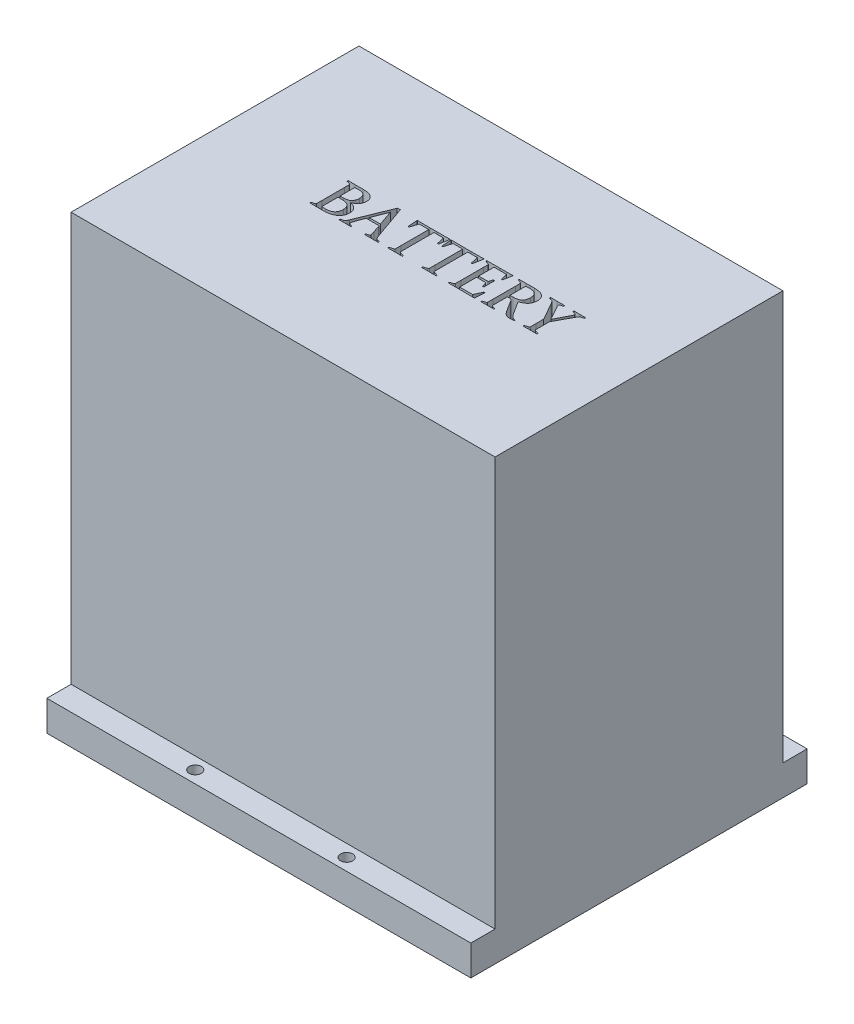
from build123d import *

# Parameters (mm, degrees)
SKETCH1_W           = 140
SKETCH1_H           = 95.06
BOSS_EXTRUDE1_DEPTH = 135
CUT_EXTRUDE1_DEPTH  = 10
SKETCH5_W           = 140
SKETCH5_H           = 111.06
SKETCH5_R           = 2
SKETCH5_R_2         = 1.194483332
SKETCH5_R_3         = 1.393191893
BOSS_EXTRUDE2_DEPTH = 10
SKETCH6_R           = 2
CUT_EXTRUDE2_DEPTH  = 206.46865484


with BuildPart() as part:
    # Sketch1 → Boss-Extrude1 (new body)
    with BuildSketch(Plane(origin=(0, 0, 0), x_dir=(1, 0, 0), z_dir=(0, 1, 0))):
        with Locations((-34.524886878, -45.795791855)):
            Rectangle(SKETCH1_W, SKETCH1_H)
    extrude(amount=BOSS_EXTRUDE1_DEPTH)

    # Sketch3 → Cut-Extrude1 (cut)
    # profile 1 of 7: a face of its own
    with BuildSketch(Plane(origin=(0, 135, 0), x_dir=(1, 0, 0), z_dir=(0, 1, 0))):
        with BuildLine():
            add(Edge.make_bspline(
                [(-67.809019882, -38.536040297), (-67.427547121, -38.546417855), (-66.669108469, -38.567050367), (-65.910393126, -38.569341939), (-65.533289712, -38.570480917)],
                knots=[0, 0, 0, 0, 1.005942301, 2, 2, 2, 2], degree=3))
            add(Edge.make_bspline(
                [(-65.533289712, -38.570480917), (-65.451169222, -38.567544733), (-65.264892055, -38.560884471), (-64.953094953, -38.557151408), (-64.57514416, -38.551262412), (-64.155660359, -38.547033522), (-63.740624652, -38.540800795), (-63.380303502, -38.539506194), (-63.096843529, -38.535502588), (-62.934348381, -38.535880219), (-62.865466334, -38.536040297)],
                knots=[0, 0, 0, 0, 0.73913045, 1.676598947, 2.80468887, 4.139292672, 5.450067671, 6.538357173, 7.380406424, 8, 8, 8, 8], degree=3))
            add(Edge.make_bspline(
                [(-62.865466334, -38.536040297), (-62.703774907, -38.537430001), (-62.390525449, -38.540122314), (-61.936010606, -38.579154485), (-61.51145673, -38.636757738), (-61.11549324, -38.713545577), (-60.751950727, -38.820593897), (-60.417858436, -38.947108155), (-60.114448975, -39.097674369), (-59.842426737, -39.272850081), (-59.603227642, -39.47091103), (-59.389655057, -39.68488596), (-59.215935664, -39.926858102), (-59.067795267, -40.183925865), (-58.955693763, -40.464150085), (-58.877496749, -40.764124192), (-58.828406865, -41.084806574), (-58.822864742, -41.305236873), (-58.820018173, -41.418455228)],
                knots=[0, 0, 0, 0, 1.378203886, 2.670034086, 3.88606819, 5.030458177, 6.105049954, 7.113226739, 8.072889222, 8.987638, 9.864930817, 10.716848378, 11.557174684, 12.396758562, 13.241257251, 14.12154981, 15.035182359, 16, 16, 16, 16], degree=3))
            add(Edge.make_bspline(
                [(-58.820018173, -41.418455228), (-58.820908478, -41.510408625), (-58.822651146, -41.69039663), (-58.855124518, -41.95465016), (-58.896719198, -42.208981625), (-58.965856813, -42.450581441), (-59.045185739, -42.682889705), (-59.152216652, -42.900353287), (-59.268678788, -43.111588819), (-59.412009446, -43.306468355), (-59.567088476, -43.494858725), (-59.747673955, -43.665206173), (-59.939750318, -43.831257244), (-60.154115788, -43.982707642), (-60.386989663, -44.121775893), (-60.637761757, -44.252780371), (-60.906674727, -44.371789686), (-61.095284608, -44.438948204), (-61.191122367, -44.473073256)],
                knots=[0, 0, 0, 0, 1.057010299, 2.068973867, 3.05944387, 4.018196596, 4.956492417, 5.878980143, 6.802641909, 7.727364617, 8.657429372, 9.605791154, 10.578809353, 11.576753923, 12.620399978, 13.697337371, 14.829955113, 16, 16, 16, 16], degree=3))
            add(Edge.make_bspline(
                [(-61.191122367, -44.473073256), (-61.078616777, -44.493539302), (-60.858163497, -44.533642261), (-60.540869206, -44.61966028), (-60.242552593, -44.719019596), (-59.965316303, -44.839048116), (-59.708370188, -44.976515321), (-59.470457364, -45.13112253), (-59.252059911, -45.303007191), (-59.057015689, -45.494737075), (-58.879663425, -45.69850536), (-58.730153546, -45.919869868), (-58.597763617, -46.151517817), (-58.491555036, -46.398404672), (-58.413000303, -46.660259651), (-58.354917674, -46.934917554), (-58.315856557, -47.222791096), (-58.312870836, -47.419823984), (-58.311356715, -47.519743449)],
                knots=[0, 0, 0, 0, 1.187931728, 2.327737193, 3.413187731, 4.453183684, 5.463269064, 6.438220556, 7.398548252, 8.346117218, 9.276870068, 10.200947513, 11.117336382, 12.046458873, 12.987068854, 13.953690983, 14.962274252, 16, 16, 16, 16], degree=3))
            add(Edge.make_bspline(
                [(-58.311356715, -47.519743449), (-58.315455324, -47.663906306), (-58.323464481, -47.945617211), (-58.385222602, -48.356283724), (-58.487591687, -48.742681266), (-58.634536307, -49.102765096), (-58.821657173, -49.437741294), (-59.050786461, -49.747298609), (-59.3244488, -50.028743356), (-59.634616468, -50.286578643), (-59.98343952, -50.513191887), (-60.363448821, -50.713141377), (-60.776888122, -50.878919717), (-61.221252479, -51.017865636), (-61.69857691, -51.121328396), (-62.207208779, -51.198902245), (-62.747228976, -51.243155497), (-63.117952305, -51.249385008), (-63.307895831, -51.252576755)],
                knots=[0, 0, 0, 0, 0.981867809, 1.918683317, 2.822078413, 3.699124559, 4.561079493, 5.429873538, 6.31493128, 7.229318538, 8.172142545, 9.1436515, 10.15029445, 11.202629439, 12.312014813, 13.474334065, 14.705951703, 16, 16, 16, 16], degree=3))
            add(Edge.make_bspline(
                [(-63.307895831, -51.252576755), (-63.46950963, -51.252288886), (-63.806017329, -51.251689494), (-64.334035588, -51.238597476), (-64.915069564, -51.226400232), (-65.321339055, -51.226193285), (-65.53593899, -51.226083971)],
                knots=[0, 0, 0, 0, 0.870320471, 1.812156761, 2.844336023, 4, 4, 4, 4], degree=3))
            add(Edge.make_bspline(
                [(-65.53593899, -51.226083971), (-65.905970003, -51.226565663), (-66.652275977, -51.227537175), (-67.398397366, -51.244183804), (-67.774579262, -51.252576755)],
                knots=[0, 0, 0, 0, 0.991633528, 2, 2, 2, 2], degree=3))
            Line((-67.774579262, -51.252576755), (-67.809019882, -50.913469116))
            Line((-67.809019882, -50.913469116), (-66.709569334, -50.574361478))
            add(Edge.make_bspline(
                [(-66.709569334, -50.574361478), (-66.675942332, -50.562088632), (-66.612088416, -50.538783872), (-66.534063804, -50.475564404), (-66.482006467, -50.390399903), (-66.473146081, -50.325191923), (-66.468484997, -50.290888686)],
                knots=[0, 0, 0, 0, 1.072356029, 2.036284212, 2.966969876, 4, 4, 4, 4], degree=3))
            add(Edge.make_bspline(
                [(-66.468484997, -50.290888686), (-66.465555591, -50.161961552), (-66.459376186, -49.889997577), (-66.455510446, -49.459012658), (-66.448317011, -48.982164606), (-66.44938214, -48.648339378), (-66.449940048, -48.473483684)],
                knots=[0, 0, 0, 0, 0.851424291, 1.796027954, 2.845572385, 4, 4, 4, 4], degree=3))
            Line((-66.449940048, -48.473483684), (-66.449940048, -41.06080264))
            add(Edge.make_bspline(
                [(-66.449940048, -41.06080264), (-66.449371916, -40.913322078), (-66.44829344, -40.633362171), (-66.455513156, -40.234230992), (-66.459354675, -39.875651885), (-66.465554368, -39.649614983), (-66.468484997, -39.5427661)],
                knots=[0, 0, 0, 0, 1.165661162, 2.212755269, 3.155159611, 4, 4, 4, 4], degree=3))
            add(Edge.make_bspline(
                [(-66.468484997, -39.5427661), (-66.471341905, -39.505942968), (-66.476727369, -39.436528909), (-66.522648151, -39.344665725), (-66.590420393, -39.270774565), (-66.651655601, -39.245678032), (-66.68307655, -39.232800524)],
                knots=[0, 0, 0, 0, 1.089053236, 2.052937975, 3.000925474, 4, 4, 4, 4], degree=3))
            Line((-66.68307655, -39.232800524), (-67.790474933, -38.875147936))
            Line((-67.790474933, -38.875147936), (-67.809019882, -38.536040297))
        make_face()
        with BuildLine():
            Line((-64.754401853, -44.979085436), (-64.754401853, -50.256448066))
            add(Edge.make_bspline(
                [(-64.754401853, -50.256448066), (-64.65605006, -50.284658389), (-64.447929201, -50.34435386), (-64.116843115, -50.382381639), (-63.78142988, -50.397938133), (-63.55959909, -50.402586583), (-63.453606145, -50.404807658)],
                knots=[0, 0, 0, 0, 0.932933746, 1.974168104, 3.032037493, 4, 4, 4, 4], degree=3))
            add(Edge.make_bspline(
                [(-63.453606145, -50.404807658), (-63.330767627, -50.403124731), (-63.091639932, -50.399848604), (-62.744625017, -50.364433136), (-62.419650166, -50.309173621), (-62.116571324, -50.233924872), (-61.83739735, -50.13262053), (-61.580072944, -50.010641728), (-61.346449996, -49.864621599), (-61.135430096, -49.69694897), (-60.948639857, -49.507469505), (-60.786443761, -49.297722805), (-60.650069368, -49.066964092), (-60.539416024, -48.816814182), (-60.450634929, -48.547351348), (-60.391446195, -48.256565414), (-60.353632767, -47.946388047), (-60.348589495, -47.73268453), (-60.346002548, -47.623065308)],
                knots=[0, 0, 0, 0, 1.238057209, 2.410105338, 3.512269806, 4.559560237, 5.553733266, 6.501495605, 7.425414509, 8.325034372, 9.212724115, 10.101350968, 10.991537483, 11.9081781, 12.854182454, 13.846000613, 14.895105975, 16, 16, 16, 16], degree=3))
            add(Edge.make_bspline(
                [(-60.346002548, -47.623065308), (-60.348666269, -47.513466888), (-60.353837904, -47.300680758), (-60.390188275, -46.99261248), (-60.454165101, -46.707042144), (-60.54138696, -46.443090734), (-60.652717878, -46.199583246), (-60.790592681, -45.977805268), (-60.957241654, -45.780737435), (-61.146884547, -45.603583227), (-61.365399797, -45.448568437), (-61.612601292, -45.312285035), (-61.893430381, -45.203620437), (-62.202153165, -45.109610008), (-62.542989393, -45.040393906), (-62.913422688, -44.986464976), (-63.315433327, -44.959112307), (-63.59310161, -44.954818887), (-63.737078937, -44.952592652)],
                knots=[0, 0, 0, 0, 1.05999139, 2.057980992, 2.994616073, 3.885952831, 4.742010155, 5.578585574, 6.403171339, 7.231156379, 8.082085007, 8.988034817, 9.953965965, 10.988883383, 12.106237805, 13.314170885, 14.607336449, 16, 16, 16, 16], degree=3))
            add(Edge.make_bspline(
                [(-63.737078937, -44.952592652), (-63.90843494, -44.952984912), (-64.247753603, -44.953761665), (-64.586648806, -44.970700645), (-64.754401853, -44.979085436)],
                knots=[0, 0, 0, 0, 1.010000458, 2, 2, 2, 2], degree=3))
        make_face(mode=Mode.SUBTRACT)
        with BuildLine():
            add(Edge.make_bspline(
                [(-64.754401853, -44.292922323), (-64.562772242, -44.294910272), (-64.177753045, -44.29890443), (-63.79271534, -44.300212921), (-63.599316458, -44.300870158)],
                knots=[0, 0, 0, 0, 0.995428867, 2, 2, 2, 2], degree=3))
            add(Edge.make_bspline(
                [(-63.599316458, -44.300870158), (-63.489755054, -44.298676327), (-63.276415266, -44.294404464), (-62.967193463, -44.26605633), (-62.678234196, -44.215867258), (-62.410614699, -44.144489167), (-62.162982894, -44.054589507), (-61.935589601, -43.946248387), (-61.729902543, -43.815727805), (-61.546170365, -43.663882675), (-61.383694839, -43.49228408), (-61.23909712, -43.304521638), (-61.120074181, -43.09522154), (-61.021316985, -42.869924216), (-60.948054208, -42.624865793), (-60.891889207, -42.363768167), (-60.860488447, -42.083304966), (-60.856643088, -41.890984575), (-60.854664006, -41.792003486)],
                knots=[0, 0, 0, 0, 1.237178968, 2.409055454, 3.502577501, 4.545123155, 5.532558798, 6.47363837, 7.383776903, 8.276262588, 9.157930545, 10.047458661, 10.94544277, 11.869891171, 12.819334189, 13.828534526, 14.882416913, 16, 16, 16, 16], degree=3))
            add(Edge.make_bspline(
                [(-60.854664006, -41.792003486), (-60.856276096, -41.688570236), (-60.859386134, -41.489027096), (-60.895044492, -41.201010355), (-60.950057065, -40.934917185), (-61.025416047, -40.689596913), (-61.126835219, -40.468313975), (-61.249664009, -40.269070878), (-61.395865811, -40.093214037), (-61.565819318, -39.940833312), (-61.754868645, -39.808389449), (-61.962790296, -39.693934257), (-62.190537805, -39.598802907), (-62.437516591, -39.518711531), (-62.705703316, -39.459577656), (-62.992226357, -39.414119928), (-63.298556966, -39.387453357), (-63.509188234, -39.385049593), (-63.617861407, -39.383809394)],
                knots=[0, 0, 0, 0, 1.177231098, 2.271110987, 3.298638014, 4.268657357, 5.186615539, 6.062809601, 6.926742094, 7.781081906, 8.65432805, 9.549983417, 10.478238827, 11.460894017, 12.502544614, 13.601957102, 14.762752866, 16, 16, 16, 16], degree=3))
            add(Edge.make_bspline(
                [(-63.617861407, -39.383809394), (-63.700883994, -39.384179564), (-63.874941562, -39.384955627), (-64.146980935, -39.396749909), (-64.443183193, -39.413782186), (-64.647625969, -39.435860873), (-64.754401853, -39.447392077)],
                knots=[0, 0, 0, 0, 0.874677504, 1.83376891, 2.868626, 4, 4, 4, 4], degree=3))
            Line((-64.754401853, -39.447392077), (-64.754401853, -44.292922323))
        make_face(mode=Mode.SUBTRACT)
    # profile 2 of 7: a face of its own
    with BuildSketch(Plane(origin=(0, 135, 0), x_dir=(1, 0, 0), z_dir=(0, 1, 0))):
        with BuildLine():
            Line((-50.890727835, -38.196932658), (-46.922108749, -49.459015259))
            add(Edge.make_bspline(
                [(-46.922108749, -49.459015259), (-46.885663146, -49.556391089), (-46.818572642, -49.735644359), (-46.71727249, -49.97893096), (-46.617774069, -50.169388956), (-46.52207984, -50.317727821), (-46.415151059, -50.430782604), (-46.290833352, -50.520236854), (-46.149463946, -50.598234463), (-46.045791974, -50.636640187), (-45.992212021, -50.656489109)],
                knots=[0, 0, 0, 0, 1.574516787, 2.898432601, 3.987097625, 4.825290635, 5.56306803, 6.327976849, 7.135861677, 8, 8, 8, 8], degree=3))
            Line((-45.992212021, -50.656489109), (-45.14974148, -50.913469116))
            Line((-45.14974148, -50.913469116), (-45.13384581, -51.252576755))
            add(Edge.make_bspline(
                [(-45.13384581, -51.252576755), (-45.325480074, -51.249283394), (-45.70168619, -51.242818045), (-46.255315735, -51.229235603), (-46.787885158, -51.229307688), (-47.13581929, -51.227143899), (-47.306254121, -51.226083971)],
                knots=[0, 0, 0, 0, 1.058612849, 2.078212005, 3.058616038, 4, 4, 4, 4], degree=3))
            add(Edge.make_bspline(
                [(-47.306254121, -51.226083971), (-47.483754084, -51.227132376), (-47.853766087, -51.229317855), (-48.432247844, -51.229365395), (-49.056530067, -51.243051412), (-49.488373005, -51.249328915), (-49.711798935, -51.252576755)],
                knots=[0, 0, 0, 0, 0.885404967, 1.84569315, 2.885409556, 4, 4, 4, 4], degree=3))
            Line((-49.711798935, -51.252576755), (-49.746239554, -50.913469116))
            Line((-49.746239554, -50.913469116), (-48.898470457, -50.645891995))
            add(Edge.make_bspline(
                [(-48.898470457, -50.645891995), (-48.846417956, -50.624085931), (-48.755473136, -50.585986925), (-48.638131491, -50.50604919), (-48.572638726, -50.383620697), (-48.569216995, -50.291741085), (-48.567310653, -50.240552396)],
                knots=[0, 0, 0, 0, 1.191052092, 2.08097623, 2.930858445, 4, 4, 4, 4], degree=3))
            add(Edge.make_bspline(
                [(-48.567310653, -50.240552396), (-48.572947489, -50.165975309), (-48.58588283, -49.994836742), (-48.652354838, -49.773201628), (-48.714787482, -49.559195484), (-48.776571081, -49.365094737), (-48.848566327, -49.145662807), (-48.898557426, -48.990123051), (-48.924963241, -48.907965346)],
                knots=[0, 0, 0, 0, 0.970738523, 2.227638644, 2.994762933, 3.874229025, 4.877145812, 6, 6, 6, 6], degree=3))
            Line((-48.924963241, -48.907965346), (-49.764784503, -46.335515991))
            Line((-49.764784503, -46.335515991), (-54.075160507, -46.335515991))
            Line((-54.075160507, -46.335515991), (-55.013005071, -48.907965346))
            add(Edge.make_bspline(
                [(-55.013005071, -48.907965346), (-55.043443713, -48.993482262), (-55.100759002, -49.154508717), (-55.175727685, -49.384794235), (-55.248445012, -49.583904019), (-55.30857445, -49.758239647), (-55.353100293, -49.910604503), (-55.390319952, -50.043102204), (-55.408792127, -50.16057938), (-55.413516894, -50.233447242), (-55.415695392, -50.26704518)],
                knots=[0, 0, 0, 0, 1.53230722, 2.885300472, 4.087661103, 5.110660653, 5.997387815, 6.767555662, 7.431744164, 8, 8, 8, 8], degree=3))
            add(Edge.make_bspline(
                [(-55.415695392, -50.26704518), (-55.412958036, -50.315859519), (-55.407924413, -50.405622406), (-55.334909342, -50.522500589), (-55.218034627, -50.600003531), (-55.12690818, -50.6346873), (-55.076587753, -50.65383983)],
                knots=[0, 0, 0, 0, 1.036269142, 1.905557071, 2.843439335, 4, 4, 4, 4], degree=3))
            Line((-55.076587753, -50.65383983), (-54.244714326, -50.913469116))
            Line((-54.244714326, -50.913469116), (-54.226169377, -51.252576755))
            add(Edge.make_bspline(
                [(-54.226169377, -51.252576755), (-54.428402486, -51.249383273), (-54.812563624, -51.243316948), (-55.360003404, -51.229442517), (-55.849300338, -51.229348629), (-56.156612074, -51.227125341), (-56.300554387, -51.226083971)],
                knots=[0, 0, 0, 0, 1.169919131, 2.222373308, 3.16737414, 4, 4, 4, 4], degree=3))
            add(Edge.make_bspline(
                [(-56.300554387, -51.226083971), (-56.438314442, -51.227139717), (-56.721781928, -51.229312114), (-57.15898978, -51.229280213), (-57.619878998, -51.242911381), (-57.935155059, -51.249301294), (-58.096765162, -51.252576755)],
                knots=[0, 0, 0, 0, 0.920242704, 1.893574212, 2.920248855, 4, 4, 4, 4], degree=3))
            Line((-58.096765162, -51.252576755), (-58.141802895, -50.913469116))
            Line((-58.141802895, -50.913469116), (-57.238398951, -50.627347046))
            add(Edge.make_bspline(
                [(-57.238398951, -50.627347046), (-57.184475776, -50.609052337), (-57.080899193, -50.573911536), (-56.946307994, -50.490931843), (-56.827133897, -50.402338232), (-56.734518486, -50.285978373), (-56.653174352, -50.147505975), (-56.560107731, -49.986754325), (-56.473542851, -49.788283513), (-56.412616319, -49.646246507), (-56.38003274, -49.570284953)],
                knots=[0, 0, 0, 0, 0.960439586, 1.844829266, 2.664180003, 3.460297701, 4.339620655, 5.383436748, 6.600658962, 8, 8, 8, 8], degree=3))
            Line((-56.38003274, -49.570284953), (-51.812676729, -38.334695136))
            Line((-51.812676729, -38.334695136), (-50.890727835, -38.196932658))
        make_face()
        Polygon((-53.744000703, -45.657300714), (-50.058854409, -45.657300714), (-51.802079615, -40.599828193), align=None, mode=Mode.SUBTRACT)
    # profile 3 of 7: a face of its own
    with BuildSketch(Plane(origin=(0, 135, 0), x_dir=(1, 0, 0), z_dir=(0, 1, 0))):
        with BuildLine():
            add(Edge.make_bspline(
                [(-39.641891627, -51.226083971), (-39.826456241, -51.227137109), (-40.205299181, -51.229298811), (-40.790846489, -51.22931791), (-41.408065797, -51.242879996), (-41.831075724, -51.249295407), (-42.04743644, -51.252576755)],
                knots=[0, 0, 0, 0, 0.920642888, 1.889739583, 2.920646004, 4, 4, 4, 4], degree=3))
            Line((-42.04743644, -51.252576755), (-42.08187706, -50.913469116))
            Line((-42.08187706, -50.913469116), (-40.759887124, -50.508129517))
            add(Edge.make_bspline(
                [(-40.759887124, -50.508129517), (-40.726240452, -50.495956108), (-40.661812626, -50.472646038), (-40.584410998, -50.408074642), (-40.538290198, -50.320246307), (-40.530757514, -50.25611897), (-40.526750622, -50.222007447)],
                knots=[0, 0, 0, 0, 1.07619582, 2.060737424, 2.968439932, 4, 4, 4, 4], degree=3))
            add(Edge.make_bspline(
                [(-40.526750622, -50.222007447), (-40.523817632, -50.096612849), (-40.517580345, -49.829949051), (-40.513784791, -49.406026827), (-40.506567751, -48.933594867), (-40.507641575, -48.602418646), (-40.508205673, -48.42844595)],
                knots=[0, 0, 0, 0, 0.839114093, 1.784457676, 2.836136637, 4, 4, 4, 4], degree=3))
            Line((-40.508205673, -48.42844595), (-40.508205673, -39.214255575))
            Line((-40.508205673, -39.214255575), (-43.66614556, -39.214255575))
            Line((-43.66614556, -39.214255575), (-44.460929089, -41.760212145))
            Line((-44.460929089, -41.760212145), (-44.818581677, -41.826444106))
            Line((-44.818581677, -41.826444106), (-45.051718178, -38.573130195))
            Line((-45.051718178, -38.573130195), (-44.988135496, -38.501599677))
            add(Edge.make_bspline(
                [(-44.988135496, -38.501599677), (-44.625189054, -38.507242887), (-43.907264153, -38.518405417), (-42.842238874, -38.528962511), (-41.801057851, -38.533779174), (-41.11489076, -38.535292434), (-40.775782794, -38.536040297)],
                knots=[0, 0, 0, 0, 1.034026858, 2.045353098, 3.034001568, 4, 4, 4, 4], degree=3))
            Line((-40.775782794, -38.536040297), (-38.444417777, -38.536040297))
            add(Edge.make_bspline(
                [(-38.444417777, -38.536040297), (-38.106192912, -38.535290356), (-37.420025856, -38.533768927), (-36.377078676, -38.528957489), (-35.305872414, -38.518366881), (-34.582648306, -38.507238669), (-34.216169404, -38.501599677)],
                knots=[0, 0, 0, 0, 0.95986119, 1.947299551, 2.95983638, 4, 4, 4, 4], degree=3))
            Line((-34.216169404, -38.501599677), (-34.163183836, -38.573130195))
            Line((-34.163183836, -38.573130195), (-34.724830863, -41.762861423))
            Line((-34.724830863, -41.762861423), (-35.082483451, -41.826444106))
            Line((-35.082483451, -41.826444106), (-35.654727591, -39.214255575))
            Line((-35.654727591, -39.214255575), (-38.812667478, -39.214255575))
            Line((-38.812667478, -39.214255575), (-38.812667478, -48.42844595))
            add(Edge.make_bspline(
                [(-38.812667478, -48.42844595), (-38.813231577, -48.602418646), (-38.8143054, -48.933594867), (-38.80708836, -49.406026827), (-38.803292806, -49.829949051), (-38.797055519, -50.096612849), (-38.794122529, -50.222007447)],
                knots=[0, 0, 0, 0, 1.163863363, 2.215542324, 3.160885907, 4, 4, 4, 4], degree=3))
            add(Edge.make_bspline(
                [(-38.794122529, -50.222007447), (-38.790401467, -50.256298795), (-38.783359717, -50.321191846), (-38.733343407, -50.406365828), (-38.659141201, -50.473567109), (-38.594877685, -50.496195584), (-38.560986028, -50.508129517)],
                knots=[0, 0, 0, 0, 1.033432821, 1.955671374, 2.921850393, 4, 4, 4, 4], degree=3))
            Line((-38.560986028, -50.508129517), (-37.238996092, -50.913469116))
            Line((-37.238996092, -50.913469116), (-37.220451143, -51.252576755))
            add(Edge.make_bspline(
                [(-37.220451143, -51.252576755), (-37.443876967, -51.249322752), (-37.87660257, -51.24302048), (-38.503534708, -51.229350123), (-39.087314912, -51.229315499), (-39.461742397, -51.227133704), (-39.641891627, -51.226083971)],
                knots=[0, 0, 0, 0, 1.107274464, 2.144541755, 3.107278743, 4, 4, 4, 4], degree=3))
        make_face()
    # profile 4 of 7: a face of its own
    with BuildSketch(Plane(origin=(0, 135, 0), x_dir=(1, 0, 0), z_dir=(0, 1, 0))):
        with BuildLine():
            add(Edge.make_bspline(
                [(-28.451339543, -51.226083971), (-28.635904158, -51.227137109), (-29.014747097, -51.229298811), (-29.600294405, -51.22931791), (-30.217513713, -51.242879996), (-30.64052364, -51.249295407), (-30.856884357, -51.252576755)],
                knots=[0, 0, 0, 0, 0.920642888, 1.889739583, 2.920646004, 4, 4, 4, 4], degree=3))
            Line((-30.856884357, -51.252576755), (-30.891324976, -50.913469116))
            Line((-30.891324976, -50.913469116), (-29.56933504, -50.508129517))
            add(Edge.make_bspline(
                [(-29.56933504, -50.508129517), (-29.535688368, -50.495956108), (-29.471260543, -50.472646038), (-29.393858915, -50.408074642), (-29.347738114, -50.320246307), (-29.340205431, -50.25611897), (-29.336198539, -50.222007447)],
                knots=[0, 0, 0, 0, 1.07619582, 2.060737424, 2.968439932, 4, 4, 4, 4], degree=3))
            add(Edge.make_bspline(
                [(-29.336198539, -50.222007447), (-29.333265549, -50.096612849), (-29.327028262, -49.829949051), (-29.323232708, -49.406026827), (-29.316015668, -48.933594867), (-29.317089491, -48.602418646), (-29.31765359, -48.42844595)],
                knots=[0, 0, 0, 0, 0.839114093, 1.784457676, 2.836136637, 4, 4, 4, 4], degree=3))
            Line((-29.31765359, -48.42844595), (-29.31765359, -39.214255575))
            Line((-29.31765359, -39.214255575), (-32.475593477, -39.214255575))
            Line((-32.475593477, -39.214255575), (-33.270377005, -41.760212145))
            Line((-33.270377005, -41.760212145), (-33.628029593, -41.826444106))
            Line((-33.628029593, -41.826444106), (-33.861166095, -38.573130195))
            Line((-33.861166095, -38.573130195), (-33.797583413, -38.501599677))
            add(Edge.make_bspline(
                [(-33.797583413, -38.501599677), (-33.434636971, -38.507242887), (-32.71671207, -38.518405417), (-31.65168679, -38.528962511), (-30.610505768, -38.533779174), (-29.924338677, -38.535292434), (-29.585230711, -38.536040297)],
                knots=[0, 0, 0, 0, 1.034026858, 2.045353098, 3.034001568, 4, 4, 4, 4], degree=3))
            Line((-29.585230711, -38.536040297), (-27.253865693, -38.536040297))
            add(Edge.make_bspline(
                [(-27.253865693, -38.536040297), (-26.915640829, -38.535290356), (-26.229473773, -38.533768927), (-25.186526593, -38.528957489), (-24.115320331, -38.518366881), (-23.392096223, -38.507238669), (-23.025617321, -38.501599677)],
                knots=[0, 0, 0, 0, 0.95986119, 1.947299551, 2.95983638, 4, 4, 4, 4], degree=3))
            Line((-23.025617321, -38.501599677), (-22.972631753, -38.573130195))
            Line((-22.972631753, -38.573130195), (-23.534278779, -41.762861423))
            Line((-23.534278779, -41.762861423), (-23.891931367, -41.826444106))
            Line((-23.891931367, -41.826444106), (-24.464175508, -39.214255575))
            Line((-24.464175508, -39.214255575), (-27.622115395, -39.214255575))
            Line((-27.622115395, -39.214255575), (-27.622115395, -48.42844595))
            add(Edge.make_bspline(
                [(-27.622115395, -48.42844595), (-27.622679493, -48.602418646), (-27.623753317, -48.933594867), (-27.616536277, -49.406026827), (-27.612740723, -49.829949051), (-27.606503436, -50.096612849), (-27.603570446, -50.222007447)],
                knots=[0, 0, 0, 0, 1.163863363, 2.215542324, 3.160885907, 4, 4, 4, 4], degree=3))
            add(Edge.make_bspline(
                [(-27.603570446, -50.222007447), (-27.599849383, -50.256298795), (-27.592807633, -50.321191846), (-27.542791324, -50.406365828), (-27.468589118, -50.473567109), (-27.404325601, -50.496195584), (-27.370433944, -50.508129517)],
                knots=[0, 0, 0, 0, 1.033432821, 1.955671374, 2.921850393, 4, 4, 4, 4], degree=3))
            Line((-27.370433944, -50.508129517), (-26.048444008, -50.913469116))
            Line((-26.048444008, -50.913469116), (-26.029899059, -51.252576755))
            add(Edge.make_bspline(
                [(-26.029899059, -51.252576755), (-26.253324884, -51.249322752), (-26.686050487, -51.24302048), (-27.312982625, -51.229350123), (-27.896762829, -51.229315499), (-28.271190313, -51.227133704), (-28.451339543, -51.226083971)],
                knots=[0, 0, 0, 0, 1.107274464, 2.144541755, 3.107278743, 4, 4, 4, 4], degree=3))
        make_face()
    # profile 5 of 7: a face of its own
    with BuildSketch(Plane(origin=(0, 135, 0), x_dir=(1, 0, 0), z_dir=(0, 1, 0))):
        with BuildLine():
            Line((-19.84118465, -38.536040297), (-17.695269122, -38.536040297))
            add(Edge.make_bspline(
                [(-17.695269122, -38.536040297), (-17.357044258, -38.535290356), (-16.670877202, -38.533768927), (-15.627930022, -38.528957489), (-14.55672376, -38.518366881), (-13.833499652, -38.507238669), (-13.46702075, -38.501599677)],
                knots=[0, 0, 0, 0, 0.95986119, 1.947299551, 2.95983638, 4, 4, 4, 4], degree=3))
            Line((-13.46702075, -38.501599677), (-13.411385903, -38.573130195))
            Line((-13.411385903, -38.573130195), (-13.930644475, -41.418455228))
            Line((-13.930644475, -41.418455228), (-14.288297063, -41.479388631))
            Line((-14.288297063, -41.479388631), (-14.841996254, -39.214255575))
            Line((-14.841996254, -39.214255575), (-18.974870603, -39.214255575))
            Line((-18.974870603, -39.214255575), (-18.974870603, -44.300870158))
            Line((-18.974870603, -44.300870158), (-18.161542126, -44.300870158))
            add(Edge.make_bspline(
                [(-18.161542126, -44.300870158), (-18.001699314, -44.301394222), (-17.674056409, -44.302468439), (-17.168964868, -44.293940117), (-16.637292436, -44.294533173), (-16.273484362, -44.288211952), (-16.087157116, -44.284974488)],
                knots=[0, 0, 0, 0, 0.924608237, 1.895245239, 2.922032839, 4, 4, 4, 4], degree=3))
            add(Edge.make_bspline(
                [(-16.087157116, -44.284974488), (-16.051288761, -44.281949128), (-15.982898129, -44.276180639), (-15.891818244, -44.231608705), (-15.819863627, -44.161530193), (-15.795339237, -44.099981209), (-15.782490097, -44.067733656)],
                knots=[0, 0, 0, 0, 1.068716211, 2.037734312, 2.971903963, 4, 4, 4, 4], degree=3))
            Line((-15.782490097, -44.067733656), (-15.469875242, -42.944439603))
            Line((-15.469875242, -42.944439603), (-14.98505729, -42.925894654))
            add(Edge.make_bspline(
                [(-14.98505729, -42.925894654), (-14.989825663, -43.119285069), (-14.998686888, -43.478668881), (-15.0058995, -43.97676763), (-15.011730101, -44.393583916), (-15.013436362, -44.644392014), (-15.014199352, -44.756546048)],
                knots=[0, 0, 0, 0, 1.267879065, 2.356141637, 3.264914697, 4, 4, 4, 4], degree=3))
            add(Edge.make_bspline(
                [(-15.014199352, -44.756546048), (-15.013432171, -44.866050781), (-15.011705966, -45.112443374), (-15.005894611, -45.523078085), (-14.998677848, -46.015878503), (-14.989824678, -46.371729755), (-14.98505729, -46.563353936)],
                knots=[0, 0, 0, 0, 0.727191112, 1.636226109, 2.727119176, 4, 4, 4, 4], degree=3))
            Line((-14.98505729, -46.563353936), (-15.469875242, -46.597794556))
            Line((-15.469875242, -46.597794556), (-15.790437932, -45.262558228))
            add(Edge.make_bspline(
                [(-15.790437932, -45.262558228), (-15.803570048, -45.224602561), (-15.827889673, -45.154311715), (-15.889599353, -45.067566546), (-15.972726455, -45.011200036), (-16.035999298, -45.002245726), (-16.068612167, -44.997630385)],
                knots=[0, 0, 0, 0, 1.165841965, 2.159045699, 3.051112636, 4, 4, 4, 4], degree=3))
            add(Edge.make_bspline(
                [(-16.068612167, -44.997630385), (-16.257591149, -44.994716789), (-16.626709278, -44.989025886), (-17.16630229, -44.985129361), (-17.677590655, -44.977707505), (-18.008764632, -44.978635205), (-18.169489961, -44.979085436)],
                knots=[0, 0, 0, 0, 1.079495133, 2.108494915, 3.082014899, 4, 4, 4, 4], degree=3))
            Line((-18.169489961, -44.979085436), (-18.974870603, -44.979085436))
            Line((-18.974870603, -44.979085436), (-18.974870603, -48.473483684))
            add(Edge.make_bspline(
                [(-18.974870603, -48.473483684), (-18.973784911, -48.825843738), (-18.971627058, -49.526171952), (-18.961404754, -50.226428785), (-18.956325654, -50.574361478)],
                knots=[0, 0, 0, 0, 1.006271195, 2, 2, 2, 2], degree=3))
            Line((-18.956325654, -50.574361478), (-14.6644946, -50.574361478))
            Line((-14.6644946, -50.574361478), (-13.572991887, -48.094636868))
            Line((-13.572991887, -48.094636868), (-13.170301566, -48.023106351))
            Line((-13.170301566, -48.023106351), (-13.368997448, -51.215486857))
            Line((-13.368997448, -51.215486857), (-13.429930852, -51.27906954))
            add(Edge.make_bspline(
                [(-13.429930852, -51.27906954), (-13.808779317, -51.275783282), (-14.55058192, -51.269348639), (-15.641165757, -51.255726481), (-16.686780454, -51.255804115), (-17.369408932, -51.253636653), (-17.703216958, -51.252576755)],
                knots=[0, 0, 0, 0, 1.063875567, 2.083116964, 3.062636615, 4, 4, 4, 4], degree=3))
            Line((-17.703216958, -51.252576755), (-19.804094752, -51.252576755))
            add(Edge.make_bspline(
                [(-19.804094752, -51.252576755), (-20.162630432, -51.252576755), (-20.892948186, -51.252576755), (-21.623265939, -51.252576755), (-21.995048012, -51.252576755)],
                knots=[0, 0, 0, 0, 0.981862152, 2, 2, 2, 2], degree=3))
            Line((-21.995048012, -51.252576755), (-22.029488632, -50.913469116))
            Line((-22.029488632, -50.913469116), (-20.930038084, -50.574361478))
            add(Edge.make_bspline(
                [(-20.930038084, -50.574361478), (-20.896411082, -50.562088632), (-20.832557166, -50.538783872), (-20.754532554, -50.475564404), (-20.702475217, -50.390399903), (-20.693614831, -50.325191923), (-20.688953747, -50.290888686)],
                knots=[0, 0, 0, 0, 1.072356029, 2.036284212, 2.966969876, 4, 4, 4, 4], degree=3))
            add(Edge.make_bspline(
                [(-20.688953747, -50.290888686), (-20.686024341, -50.161961552), (-20.679844936, -49.889997577), (-20.675979196, -49.459012658), (-20.668785761, -48.982164606), (-20.66985089, -48.648339378), (-20.670408798, -48.473483684)],
                knots=[0, 0, 0, 0, 0.851424291, 1.796027954, 2.845572385, 4, 4, 4, 4], degree=3))
            Line((-20.670408798, -48.473483684), (-20.670408798, -41.06080264))
            add(Edge.make_bspline(
                [(-20.670408798, -41.06080264), (-20.669840666, -40.913322078), (-20.66876219, -40.633362171), (-20.675981906, -40.234230992), (-20.679823425, -39.875651885), (-20.686023118, -39.649614983), (-20.688953747, -39.5427661)],
                knots=[0, 0, 0, 0, 1.165661162, 2.212755269, 3.155159611, 4, 4, 4, 4], degree=3))
            add(Edge.make_bspline(
                [(-20.688953747, -39.5427661), (-20.691810655, -39.505942968), (-20.697196119, -39.436528909), (-20.743116901, -39.344665725), (-20.810889143, -39.270774565), (-20.872124351, -39.245678032), (-20.9035453, -39.232800524)],
                knots=[0, 0, 0, 0, 1.089053236, 2.052937975, 3.000925474, 4, 4, 4, 4], degree=3))
            Line((-20.9035453, -39.232800524), (-22.010943683, -38.875147936))
            Line((-22.010943683, -38.875147936), (-22.029488632, -38.536040297))
            add(Edge.make_bspline(
                [(-22.029488632, -38.536040297), (-21.655057281, -38.536040297), (-20.92562262, -38.536040297), (-20.196187959, -38.536040297), (-19.84118465, -38.536040297)],
                knots=[0, 0, 0, 0, 1.026634383, 2, 2, 2, 2], degree=3))
        make_face()
    # profile 6 of 7: a face of its own
    with BuildSketch(Plane(origin=(0, 135, 0), x_dir=(1, 0, 0), z_dir=(0, 1, 0))):
        with BuildLine():
            add(Edge.make_bspline(
                [(-8.292979978, -48.54766348), (-8.292058725, -48.715450885), (-8.29030834, -49.034247446), (-8.288404504, -49.488170214), (-8.283332303, -49.896179446), (-8.277297243, -50.153130348), (-8.274435029, -50.274993015)],
                knots=[0, 0, 0, 0, 1.16556873, 2.214583996, 3.153240739, 4, 4, 4, 4], degree=3))
            add(Edge.make_bspline(
                [(-8.274435029, -50.274993015), (-8.270598777, -50.31700174), (-8.26340171, -50.39581292), (-8.217494154, -50.501377333), (-8.141858175, -50.582194101), (-8.075440402, -50.608517182), (-8.041298528, -50.622048489)],
                knots=[0, 0, 0, 0, 1.12342583, 2.107622107, 3.027228327, 4, 4, 4, 4], degree=3))
            Line((-8.041298528, -50.622048489), (-7.050468395, -50.913469116))
            Line((-7.050468395, -50.913469116), (-7.021326333, -51.252576755))
            add(Edge.make_bspline(
                [(-7.021326333, -51.252576755), (-7.373663688, -51.244184621), (-8.073857714, -51.227507075), (-8.774249306, -51.226556311), (-9.122204127, -51.226083971)],
                knots=[0, 0, 0, 0, 1.006399206, 2, 2, 2, 2], degree=3))
            add(Edge.make_bspline(
                [(-9.122204127, -51.226083971), (-9.480754624, -51.226611718), (-10.211165165, -51.227686803), (-10.941391251, -51.244179925), (-11.313157387, -51.252576755)],
                knots=[0, 0, 0, 0, 0.98177799, 2, 2, 2, 2], degree=3))
            Line((-11.313157387, -51.252576755), (-11.347598007, -50.913469116))
            Line((-11.347598007, -50.913469116), (-10.248147459, -50.574361478))
            add(Edge.make_bspline(
                [(-10.248147459, -50.574361478), (-10.214520457, -50.562088632), (-10.150666541, -50.538783872), (-10.072641929, -50.475564404), (-10.020584592, -50.390399903), (-10.011724206, -50.325191923), (-10.007063122, -50.290888686)],
                knots=[0, 0, 0, 0, 1.072356029, 2.036284212, 2.966969876, 4, 4, 4, 4], degree=3))
            add(Edge.make_bspline(
                [(-10.007063122, -50.290888686), (-10.004133716, -50.161961552), (-9.997954311, -49.889997577), (-9.994088571, -49.459012658), (-9.986895136, -48.982164606), (-9.987960265, -48.648339378), (-9.988518173, -48.473483684)],
                knots=[0, 0, 0, 0, 0.851424291, 1.796027954, 2.845572385, 4, 4, 4, 4], degree=3))
            Line((-9.988518173, -48.473483684), (-9.988518173, -41.06080264))
            add(Edge.make_bspline(
                [(-9.988518173, -41.06080264), (-9.987950041, -40.913322078), (-9.986871565, -40.633362171), (-9.994091281, -40.234230992), (-9.9979328, -39.875651885), (-10.004132493, -39.649614983), (-10.007063122, -39.5427661)],
                knots=[0, 0, 0, 0, 1.165661162, 2.212755269, 3.155159611, 4, 4, 4, 4], degree=3))
            add(Edge.make_bspline(
                [(-10.007063122, -39.5427661), (-10.00992003, -39.505942968), (-10.015305494, -39.436528909), (-10.061226276, -39.344665725), (-10.128998518, -39.270774565), (-10.190233726, -39.245678032), (-10.221654675, -39.232800524)],
                knots=[0, 0, 0, 0, 1.089053236, 2.052937975, 3.000925474, 4, 4, 4, 4], degree=3))
            Line((-10.221654675, -39.232800524), (-11.329053058, -38.875147936))
            Line((-11.329053058, -38.875147936), (-11.347598007, -38.536040297))
            add(Edge.make_bspline(
                [(-11.347598007, -38.536040297), (-10.967008425, -38.546418288), (-10.212101897, -38.567003225), (-9.456918955, -38.569328125), (-9.08246495, -38.570480917)],
                knots=[0, 0, 0, 0, 1.008309156, 2, 2, 2, 2], degree=3))
            add(Edge.make_bspline(
                [(-9.08246495, -38.570480917), (-8.99944416, -38.570049277), (-8.813917089, -38.569084688), (-8.503157828, -38.556129473), (-8.126185938, -38.541624866), (-7.851452074, -38.538006262), (-7.702190889, -38.536040297)],
                knots=[0, 0, 0, 0, 0.721468326, 1.612269701, 2.702761104, 4, 4, 4, 4], degree=3))
            add(Edge.make_bspline(
                [(-7.702190889, -38.536040297), (-7.551182018, -38.536040297), (-7.277423247, -38.536040297), (-6.904758082, -38.536040297), (-6.608038898, -38.536040297), (-6.434069614, -38.536040297), (-6.359006725, -38.536040297)],
                knots=[0, 0, 0, 0, 1.349112426, 2.445759369, 3.32938856, 4, 4, 4, 4], degree=3))
            add(Edge.make_bspline(
                [(-6.359006725, -38.536040297), (-6.190264458, -38.538601709), (-5.863833367, -38.543556748), (-5.390563736, -38.581011224), (-4.949883741, -38.64125914), (-4.540929062, -38.72405508), (-4.165352481, -38.835855404), (-3.821996871, -38.970796445), (-3.509311527, -39.128342909), (-3.232875111, -39.315940841), (-2.985901095, -39.523008071), (-2.7731319, -39.755187838), (-2.590760856, -40.009088109), (-2.441318178, -40.286547666), (-2.327112061, -40.587799616), (-2.249854542, -40.911189649), (-2.196435495, -41.255088254), (-2.191553714, -41.492417408), (-2.189042478, -41.614501831)],
                knots=[0, 0, 0, 0, 1.373939338, 2.657878926, 3.862977708, 4.994036763, 6.051984536, 7.049479102, 7.994998342, 8.896479064, 9.763814478, 10.613714993, 11.453824405, 12.303207606, 13.172627177, 14.069074787, 15.006713304, 16, 16, 16, 16], degree=3))
            add(Edge.make_bspline(
                [(-2.189042478, -41.614501831), (-2.190873268, -41.724965591), (-2.194470994, -41.942040454), (-2.228700976, -42.25948484), (-2.288799954, -42.559842406), (-2.362848065, -42.846059997), (-2.468327353, -43.113657472), (-2.592090988, -43.367573416), (-2.741923007, -43.603508297), (-2.911646467, -43.825701293), (-3.10799013, -44.029492166), (-3.32365855, -44.224940732), (-3.564257329, -44.407459252), (-3.831685305, -44.573916656), (-4.120591528, -44.729508838), (-4.431944661, -44.876593678), (-4.76844499, -45.008792633), (-5.003879567, -45.0837577), (-5.124442978, -45.122146471)],
                knots=[0, 0, 0, 0, 1.066375877, 2.09555964, 3.077161004, 4.022426913, 4.945591025, 5.849334685, 6.745930503, 7.639602367, 8.544310879, 9.474066861, 10.447822873, 11.455591219, 12.512413436, 13.614760254, 14.778545442, 16, 16, 16, 16], degree=3))
            add(Edge.make_bspline(
                [(-5.124442978, -45.122146471), (-4.935428488, -45.402686712), (-4.566783291, -45.949839539), (-4.06000411, -46.765744357), (-3.584906176, -47.528042418), (-3.212333047, -48.126199275), (-2.929733127, -48.568970126), (-2.730841036, -48.87294904), (-2.543193909, -49.158474417), (-2.36713436, -49.424773855), (-2.195084334, -49.66461444), (-2.032391155, -49.880530802), (-1.872384507, -50.06658848), (-1.765577718, -50.17912543), (-1.71482164, -50.23260456)],
                knots=[0, 0, 0, 0, 1.979920897, 3.861546963, 5.621521729, 7.237935787, 7.986456609, 8.696166828, 9.364277827, 9.986498717, 10.564574258, 11.09186048, 11.568439417, 12, 12, 12, 12], degree=3))
            add(Edge.make_bspline(
                [(-1.71482164, -50.23260456), (-1.665217561, -50.281076322), (-1.569339623, -50.374765645), (-1.417124546, -50.498916102), (-1.259277314, -50.599865594), (-1.095473795, -50.684469299), (-0.921661898, -50.746902768), (-0.741996276, -50.811627778), (-0.54603556, -50.86229174), (-0.410510305, -50.895929872), (-0.339846135, -50.913469116)],
                knots=[0, 0, 0, 0, 1.066453224, 2.06130902, 3.01449663, 3.943871608, 4.889773601, 5.851918761, 6.879969814, 8, 8, 8, 8], degree=3))
            Line((-0.339846135, -50.913469116), (-0.313353351, -51.19429263))
            add(Edge.make_bspline(
                [(-0.313353351, -51.19429263), (-0.416615679, -51.203998233), (-0.61324127, -51.222479028), (-0.897089679, -51.235380957), (-1.153873319, -51.252224412), (-1.317405084, -51.252464107), (-1.39425895, -51.252576755)],
                knots=[0, 0, 0, 0, 1.149186279, 2.188207784, 3.148524834, 4, 4, 4, 4], degree=3))
            add(Edge.make_bspline(
                [(-1.39425895, -51.252576755), (-1.509051674, -51.250996925), (-1.724558817, -51.248031017), (-2.028937397, -51.24106223), (-2.297127325, -51.214239921), (-2.536274258, -51.17372116), (-2.74982815, -51.110507806), (-2.947640347, -51.037503328), (-3.131329375, -50.938959688), (-3.24592066, -50.860683378), (-3.304388697, -50.820744371)],
                knots=[0, 0, 0, 0, 1.380324856, 2.591365151, 3.658322977, 4.618350237, 5.502084813, 6.33215299, 7.149012595, 8, 8, 8, 8], degree=3))
            add(Edge.make_bspline(
                [(-3.304388697, -50.820744371), (-3.368971861, -50.772509967), (-3.502675084, -50.672652743), (-3.691058182, -50.492549323), (-3.874988793, -50.281996901), (-4.129464208, -49.957480675), (-4.440839387, -49.49382374), (-4.826864164, -48.891232021), (-5.225357746, -48.234109297), (-5.638650851, -47.539893087), (-6.06740513, -46.828845893), (-6.379949107, -46.366012803), (-6.53650838, -46.134170831)],
                knots=[0, 0, 0, 0, 0.422669588, 0.875031247, 1.364135484, 1.888822465, 3.037944898, 4.292504576, 5.644318377, 7.070000119, 8.532306861, 10, 10, 10, 10], degree=3))
            add(Edge.make_bspline(
                [(-6.53650838, -46.134170831), (-6.579173663, -46.071904151), (-6.655297458, -45.960807362), (-6.7672474, -45.81484935), (-6.869622329, -45.698124262), (-6.98436237, -45.61378615), (-7.113863598, -45.553192345), (-7.265113844, -45.517278028), (-7.446523399, -45.497966664), (-7.57851028, -45.491397397), (-7.651854599, -45.487746894)],
                knots=[0, 0, 0, 0, 1.317495967, 2.350688577, 3.212640675, 4.017539648, 4.817698653, 5.692790188, 6.71789732, 8, 8, 8, 8], degree=3))
            Line((-7.651854599, -45.487746894), (-8.292979978, -45.471851224))
            Line((-8.292979978, -45.471851224), (-8.292979978, -48.54766348))
        make_face()
        with BuildLine():
            add(Edge.make_bspline(
                [(-8.292979978, -44.613485013), (-8.114617066, -44.62052669), (-7.772096172, -44.634049241), (-7.429333706, -44.638057015), (-7.265059948, -44.639977797)],
                knots=[0, 0, 0, 0, 1.041471719, 2, 2, 2, 2], degree=3))
            add(Edge.make_bspline(
                [(-7.265059948, -44.639977797), (-7.137842361, -44.637822593), (-6.891889337, -44.633655882), (-6.536872148, -44.60528369), (-6.208202489, -44.555421124), (-5.906237213, -44.483963908), (-5.628752919, -44.395031756), (-5.377746978, -44.283872507), (-5.154107434, -44.150708796), (-4.954116561, -43.998499977), (-4.781205244, -43.822008246), (-4.631238157, -43.623205945), (-4.503283825, -43.402006913), (-4.400451279, -43.15693847), (-4.321448734, -42.889274258), (-4.263267452, -42.599487058), (-4.22878901, -42.286490008), (-4.225422241, -42.070266089), (-4.223688312, -41.958908027)],
                knots=[0, 0, 0, 0, 1.305684408, 2.524313152, 3.652377692, 4.714230734, 5.705956491, 6.639127356, 7.525153036, 8.371777779, 9.21138698, 10.052511415, 10.921545616, 11.827241249, 12.773525228, 13.78139704, 14.857391325, 16, 16, 16, 16], degree=3))
            add(Edge.make_bspline(
                [(-4.223688312, -41.958908027), (-4.225262018, -41.851051703), (-4.228314974, -41.6418129), (-4.26484222, -41.340078789), (-4.315731071, -41.059300641), (-4.391834337, -40.801108676), (-4.493609688, -40.567512975), (-4.612780034, -40.354220257), (-4.757455804, -40.165419681), (-4.923015783, -39.996174822), (-5.113108547, -39.849495975), (-5.327551117, -39.724961842), (-5.565533462, -39.618553588), (-5.828158072, -39.531442159), (-6.11669798, -39.466131562), (-6.429297909, -39.419379366), (-6.766440696, -39.389957676), (-6.999186475, -39.385902844), (-7.119349634, -39.383809394)],
                knots=[0, 0, 0, 0, 1.157306971, 2.245149082, 3.258555241, 4.21843618, 5.127231179, 5.98922298, 6.834949821, 7.672989047, 8.524488835, 9.404183157, 10.329300276, 11.318694509, 12.369721108, 13.501423902, 14.710022588, 16, 16, 16, 16], degree=3))
            add(Edge.make_bspline(
                [(-7.119349634, -39.383809394), (-7.206791022, -39.385077118), (-7.388823594, -39.387716224), (-7.671466117, -39.401891853), (-7.975469914, -39.422342474), (-8.184419071, -39.44405765), (-8.292979978, -39.455339912)],
                knots=[0, 0, 0, 0, 0.892071271, 1.8570843, 2.886634063, 4, 4, 4, 4], degree=3))
            Line((-8.292979978, -39.455339912), (-8.292979978, -44.613485013))
        make_face(mode=Mode.SUBTRACT)
    # profile 7 of 7: a face of its own
    with BuildSketch(Plane(origin=(0, 135, 0), x_dir=(1, 0, 0), z_dir=(0, 1, 0))):
        with BuildLine():
            Line((5.353453208, -44.772441718), (7.406643991, -40.758784899))
            add(Edge.make_bspline(
                [(7.406643991, -40.758784899), (7.475409217, -40.621845246), (7.601242577, -40.371259627), (7.752770147, -40.072997774), (7.849179817, -39.864108812), (7.89736487, -39.727809088), (7.925364197, -39.603909356), (7.931150135, -39.526095707), (7.933850398, -39.489780531)],
                knots=[0, 0, 0, 0, 1.993917808, 3.648666514, 4.353377031, 4.985697181, 5.526630789, 6, 6, 6, 6], degree=3))
            add(Edge.make_bspline(
                [(7.933850398, -39.489780531), (7.929590507, -39.445323459), (7.921014459, -39.355822102), (7.837444964, -39.238353093), (7.707030324, -39.148756415), (7.60051238, -39.114135118), (7.541757191, -39.095038045)],
                knots=[0, 0, 0, 0, 0.879615507, 1.770849412, 2.770402822, 4, 4, 4, 4], degree=3))
            Line((7.541757191, -39.095038045), (6.736376548, -38.875147936))
            Line((6.736376548, -38.875147936), (6.717831599, -38.536040297))
            add(Edge.make_bspline(
                [(6.717831599, -38.536040297), (7.043665805, -38.546414015), (7.702286732, -38.567382801), (8.361239111, -38.569440969), (8.694193307, -38.570480917)],
                knots=[0, 0, 0, 0, 0.989443829, 2, 2, 2, 2], degree=3))
            add(Edge.make_bspline(
                [(8.694193307, -38.570480917), (9.014785804, -38.569460911), (9.647253469, -38.567448634), (10.279373109, -38.546413098), (10.591076662, -38.536040297)],
                knots=[0, 0, 0, 0, 1.013783043, 2, 2, 2, 2], degree=3))
            Line((10.591076662, -38.536040297), (10.625517282, -38.875147936))
            Line((10.625517282, -38.875147936), (9.722113338, -39.166568563))
            add(Edge.make_bspline(
                [(9.722113338, -39.166568563), (9.671192244, -39.184649962), (9.572912126, -39.219547917), (9.438376846, -39.292790615), (9.31969458, -39.378738712), (9.190170315, -39.526244107), (9.039632632, -39.741241547), (8.931985063, -39.927728175), (8.87434424, -40.027584052)],
                knots=[0, 0, 0, 0, 0.780419804, 1.506247121, 2.208772433, 2.886714698, 4.332964456, 6, 6, 6, 6], degree=3))
            Line((8.87434424, -40.027584052), (5.779987035, -45.667897827))
            Line((5.779987035, -45.667897827), (5.779987035, -48.444341621))
            add(Edge.make_bspline(
                [(5.779987035, -48.444341621), (5.779885368, -48.61919272), (5.779691788, -48.952118744), (5.780993585, -49.427266178), (5.790418668, -49.856412203), (5.795917062, -50.127516467), (5.798531984, -50.256448066)],
                knots=[0, 0, 0, 0, 1.157790536, 2.204496293, 3.146095455, 4, 4, 4, 4], degree=3))
            add(Edge.make_bspline(
                [(5.798531984, -50.256448066), (5.803595646, -50.292786822), (5.813455334, -50.363543677), (5.88028753, -50.456295923), (5.98282202, -50.524874248), (6.066048582, -50.551815108), (6.111146839, -50.566413642)],
                knots=[0, 0, 0, 0, 0.918546395, 1.788543708, 2.801670725, 4, 4, 4, 4], degree=3))
            Line((6.111146839, -50.566413642), (7.218545222, -50.913469116))
            Line((7.218545222, -50.913469116), (7.237090171, -51.252576755))
            add(Edge.make_bspline(
                [(7.237090171, -51.252576755), (7.03309252, -51.249298695), (6.634808407, -51.242898624), (6.050268531, -51.229236149), (5.492975663, -51.22931984), (5.130028772, -51.227143176), (4.953412166, -51.226083971)],
                knots=[0, 0, 0, 0, 1.071992108, 2.092952656, 3.071995822, 4, 4, 4, 4], degree=3))
            add(Edge.make_bspline(
                [(4.953412166, -51.226083971), (4.773263222, -51.227144705), (4.405900837, -51.229307769), (3.844192457, -51.229226671), (3.260534665, -51.242835572), (2.864017598, -51.249286605), (2.661786325, -51.252576755)],
                knots=[0, 0, 0, 0, 0.943280946, 1.92355243, 2.9409721, 4, 4, 4, 4], degree=3))
            Line((2.661786325, -51.252576755), (2.627345705, -50.913469116))
            Line((2.627345705, -50.913469116), (3.824819555, -50.547868693))
            add(Edge.make_bspline(
                [(3.824819555, -50.547868693), (3.858446557, -50.535595848), (3.922300473, -50.512291087), (4.000325085, -50.44907162), (4.052382422, -50.363907119), (4.061242808, -50.298699138), (4.065903892, -50.264395901)],
                knots=[0, 0, 0, 0, 1.072356029, 2.036284212, 2.966969876, 4, 4, 4, 4], degree=3))
            add(Edge.make_bspline(
                [(4.065903892, -50.264395901), (4.068835645, -50.135468794), (4.075040075, -49.862622063), (4.078852425, -49.430753379), (4.086075569, -48.95302259), (4.085008018, -48.619197331), (4.084448841, -48.444341621)],
                knots=[0, 0, 0, 0, 0.850185146, 1.799235569, 2.847252515, 4, 4, 4, 4], degree=3))
            Line((4.084448841, -48.444341621), (4.084448841, -45.858645874))
            Line((4.084448841, -45.858645874), (0.937106068, -40.281914782))
            add(Edge.make_bspline(
                [(0.937106068, -40.281914782), (0.884602779, -40.195073962), (0.786855849, -40.033399834), (0.644111986, -39.813122418), (0.51667606, -39.63140491), (0.401364176, -39.48252799), (0.283060104, -39.361777484), (0.150085333, -39.265773096), (0.002198563, -39.184474037), (-0.106862027, -39.149778581), (-0.16234448, -39.132127943)],
                knots=[0, 0, 0, 0, 1.489603061, 2.773238199, 3.852238927, 4.747086884, 5.535404536, 6.323615594, 7.147172052, 8, 8, 8, 8], degree=3))
            Line((-0.16234448, -39.132127943), (-0.975672958, -38.875147936))
            Line((-0.975672958, -38.875147936), (-0.994217907, -38.536040297))
            add(Edge.make_bspline(
                [(-0.994217907, -38.536040297), (-0.846755732, -38.541803638), (-0.528064261, -38.554259224), (-0.014022541, -38.563839131), (0.571496176, -38.568447844), (0.985675112, -38.569777713), (1.204683189, -38.570480917)],
                knots=[0, 0, 0, 0, 0.80518329, 1.740141474, 2.805039984, 4, 4, 4, 4], degree=3))
            add(Edge.make_bspline(
                [(1.204683189, -38.570480917), (1.614458218, -38.569289818), (2.446455722, -38.566871439), (3.278206303, -38.546419338), (3.700303469, -38.536040297)],
                knots=[0, 0, 0, 0, 0.985039084, 2, 2, 2, 2], degree=3))
            Line((3.700303469, -38.536040297), (3.734744088, -38.875147936))
            Line((3.734744088, -38.875147936), (2.894922826, -39.113582994))
            add(Edge.make_bspline(
                [(2.894922826, -39.113582994), (2.839939714, -39.129050093), (2.742155907, -39.1565573), (2.622226626, -39.234546026), (2.557767106, -39.343347027), (2.549453965, -39.421047072), (2.545218074, -39.460638469)],
                knots=[0, 0, 0, 0, 1.27433617, 2.266322102, 3.116619171, 4, 4, 4, 4], degree=3))
            add(Edge.make_bspline(
                [(2.545218074, -39.460638469), (2.546723818, -39.494360777), (2.549935021, -39.566278168), (2.580239629, -39.678497139), (2.621467871, -39.80327294), (2.709267155, -39.98982662), (2.84716473, -40.248515166), (2.966045869, -40.46139685), (3.030036026, -40.575984687)],
                knots=[0, 0, 0, 0, 0.494005031, 1.053532638, 1.696971114, 2.42202575, 4.074083587, 6, 6, 6, 6], degree=3))
            Line((3.030036026, -40.575984687), (5.353453208, -44.772441718))
        make_face()
    extrude(amount=-CUT_EXTRUDE1_DEPTH, mode=Mode.SUBTRACT)

    # Sketch5 → Boss-Extrude2 (add)
    with BuildSketch(Plane.XZ):
        with Locations((-34.524886878, 45.795791855)):
            Rectangle(SKETCH5_W, SKETCH5_H)
        with Locations(Location((-59.524886878, 97.325791855, 0), (0, 0, 270))):
            Circle(SKETCH5_R, mode=Mode.SUBTRACT)
        with Locations(Location((-9.524886878, 97.325791855, 0), (0, 0, 270))):
            Circle(SKETCH5_R, mode=Mode.SUBTRACT)
        with Locations(Location((-59.524886878, -5.734208145, 0), (0, 0, 270))):
            Circle(SKETCH5_R_2, mode=Mode.SUBTRACT)
        with Locations(Location((-9.524886878, -5.734208145, 0), (0, 0, 270))):
            Circle(SKETCH5_R_3, mode=Mode.SUBTRACT)
    extrude(amount=BOSS_EXTRUDE2_DEPTH)

    # Sketch6 → Cut-Extrude2 (cut, through all)
    with BuildSketch(Plane.XZ.offset(10)):
        with Locations(Location((-59.524886878, 97.325791855, 0), (0, 0, 270))):
            Circle(SKETCH6_R)
        with Locations(Location((-59.524886878, -5.734208145, 0), (0, 0, 270))):
            Circle(SKETCH6_R)
        with Locations(Location((-9.524886878, -5.734208145, 0), (0, 0, 270))):
            Circle(SKETCH6_R)
    extrude(amount=-CUT_EXTRUDE2_DEPTH, mode=Mode.SUBTRACT)


solid = part.part
